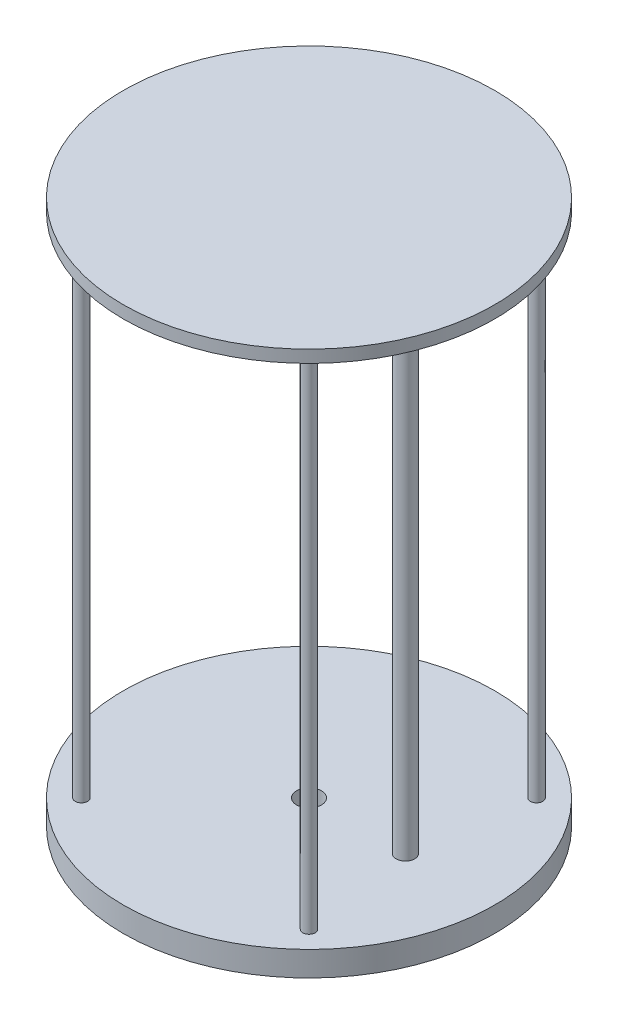
from build123d import *

# Parameters (mm, degrees)
SKETCH1_R           = 75
BOSS_EXTRUDE1_DEPTH = 10
SKETCH2_R           = 2.5
SKETCH2_R_2         = 3.75
BOSS_EXTRUDE2_DEPTH = 205
SKETCH3_R           = 75
BOSS_EXTRUDE3_DEPTH = 5
CUT_EXTRUDE1_REACH  = 246.233
SKETCH4_R           = 5


with BuildPart() as part:
    # Sketch1 → Boss-Extrude1 (new body)
    with BuildSketch(Plane(origin=(0, 0, 0), x_dir=(1, 0, 0), z_dir=(0, 1, 0))):
        with Locations(Location((0, 0, 0), (0, 0, 270))):
            Circle(SKETCH1_R)
    extrude(amount=BOSS_EXTRUDE1_DEPTH)

    # Sketch2 → Boss-Extrude2 (add)
    with BuildSketch(Plane(origin=(0, 10, 0), x_dir=(1, 0, 0), z_dir=(0, 1, 0))):
        with Locations(Location((-45.961940777, 45.961940777, 0), (0, 0, 90))):
            Circle(SKETCH2_R)
        with Locations(Location((45.961940777, 45.961940777, 0), (0, 0, 90))):
            Circle(SKETCH2_R)
        with Locations(Location((45.961940777, -45.961940777, 0), (0, 0, 90))):
            Circle(SKETCH2_R)
        with Locations(Location((-45.961940777, -45.961940777, 0), (0, 0, 90))):
            Circle(SKETCH2_R)
        with Locations(Location((38.961940777, 0, 0), (0, 0, 90))):
            Circle(SKETCH2_R_2)
    extrude(amount=BOSS_EXTRUDE2_DEPTH)

    # Sketch3 → Boss-Extrude3 (add)
    with BuildSketch(Plane(origin=(0, 215, 0), x_dir=(1, 0, 0), z_dir=(0, 1, 0))):
        with Locations(Location((0, 0, 0), (0, 0, 270))):
            Circle(SKETCH3_R)
    extrude(amount=BOSS_EXTRUDE3_DEPTH)

    # Sketch4 → Cut-Extrude1 (cut, up to next)
    with BuildSketch(Plane.XZ, mode=Mode.PRIVATE) as cut_extrude1_sk1:
        with Locations(Location((0, 0, 0), (0, 0, 270))):
            Circle(SKETCH4_R)
    cut_extrude1_tool1 = extrude(cut_extrude1_sk1.sketch, amount=-CUT_EXTRUDE1_REACH, mode=Mode.PRIVATE) & part.part
    add(cut_extrude1_tool1.solids().sort_by_distance((0, 0, 0))[0], mode=Mode.SUBTRACT)


solid = part.part
